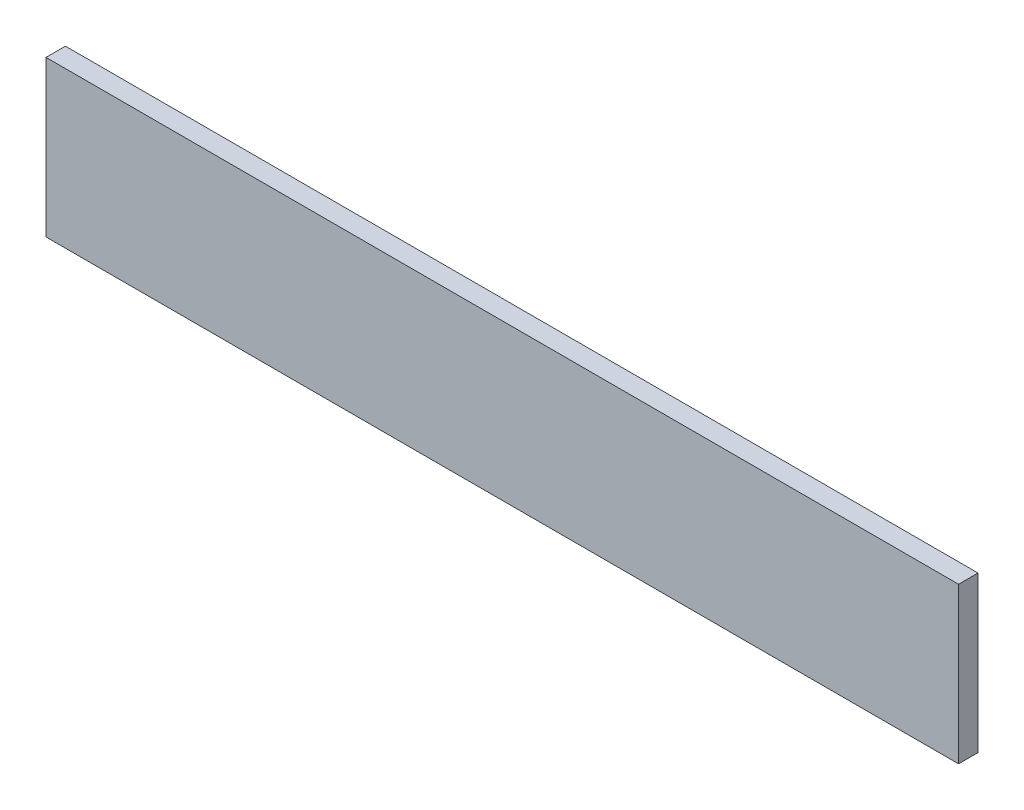
from build123d import *

# Parameters (mm, degrees)
SKETCH_1_W      = 704
SKETCH_1_H      = 120
EXTRUDE_1_DEPTH = 15


with BuildPart() as part:
    # 草图1 → 凸台-拉伸1 (new body)
    with BuildSketch(Plane.XY):
        Rectangle(SKETCH_1_W, SKETCH_1_H)
    extrude(amount=EXTRUDE_1_DEPTH)


solid = part.part
